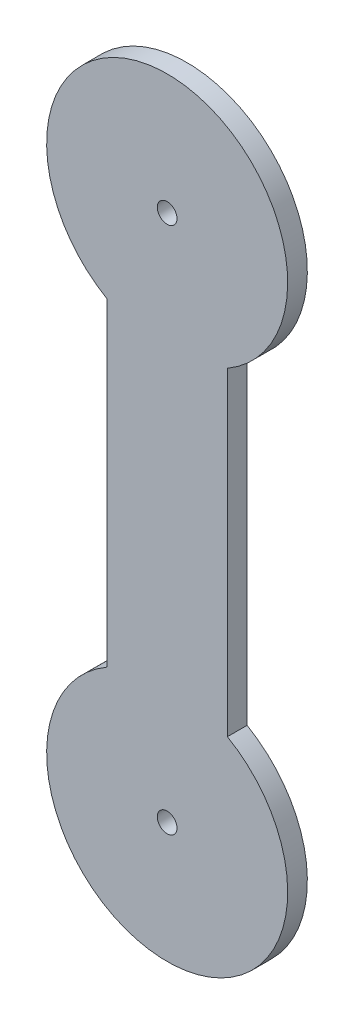
from build123d import *

# Parameters (mm, degrees)
BOSS_EXTRUDE1_DEPTH = 6.223


with BuildPart() as part:
    # Sketch1 → Boss-Extrude1 (new body)
    with BuildSketch(Plane.XY):
        with BuildLine():
            ThreePointArc((0, 133.882432116), (19.05, 128.778), (38.1, 133.882432116))
            Line((38.1, 133.882432116), (38.1, 166.878))
            Line((38.1, 166.878), (22.1615, 166.878))
            ThreePointArc((22.1615, 166.878), (19.05, 163.7665), (15.9385, 166.878))
            Line((15.9385, 166.878), (0, 166.878))
            Line((0, 166.878), (0, 133.882432116))
        make_face()
        with BuildLine():
            Line((38.1, 166.878), (38.1, 133.882432116))
            ThreePointArc((38.1, 133.882432116), (52.045567884, 147.828), (57.15, 166.878))
            ThreePointArc((57.15, 166.878), (0, 199.873567884), (0, 133.882432116))
            Line((0, 133.882432116), (0, 166.878))
            Line((0, 166.878), (15.9385, 166.878))
            ThreePointArc((15.9385, 166.878), (19.05, 169.9895), (22.1615, 166.878))
            Line((22.1615, 166.878), (38.1, 166.878))
        make_face()
        with BuildLine():
            ThreePointArc((0, 32.995567884), (19.05, 38.1), (38.1, 32.995567884))
            Line((38.1, 32.995567884), (38.1, 133.882432116))
            ThreePointArc((38.1, 133.882432116), (19.05, 128.778), (0, 133.882432116))
            Line((0, 133.882432116), (0, 32.995567884))
        make_face()
        with BuildLine():
            ThreePointArc((15.9385, 0), (19.05, 3.1115), (22.1615, 0))
            Line((22.1615, 0), (38.1, 0))
            Line((38.1, 0), (38.1, 32.995567884))
            ThreePointArc((38.1, 32.995567884), (19.05, 38.1), (0, 32.995567884))
            Line((0, 32.995567884), (0, 0))
            Line((0, 0), (15.9385, 0))
        make_face()
        with BuildLine():
            Line((38.1, 0), (22.1615, 0))
            ThreePointArc((22.1615, 0), (19.05, -3.1115), (15.9385, 0))
            Line((15.9385, 0), (0, 0))
            Line((0, 0), (0, 32.995567884))
            ThreePointArc((0, 32.995567884), (0, -32.995567884), (57.15, 0))
            ThreePointArc((57.15, 0), (52.045567884, 19.05), (38.1, 32.995567884))
            Line((38.1, 32.995567884), (38.1, 0))
        make_face()
    extrude(amount=BOSS_EXTRUDE1_DEPTH)


solid = part.part
